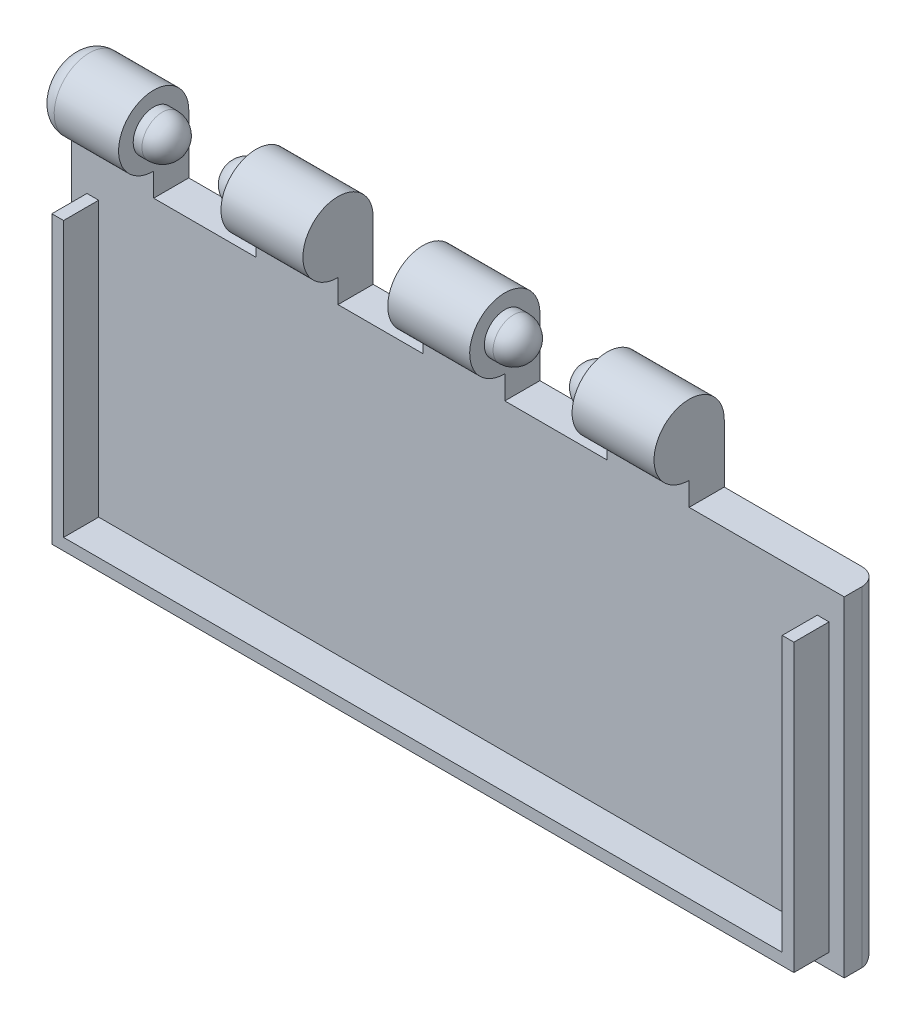
from build123d import *

# Parameters (mm, degrees)
SKETCH1_W                 = 66
SKETCH1_H                 = 28.2
BOSS_EXTRUDE1_DEPTH       = 3
BOSS_EXTRUDE4_DEPTH       = 7
SKETCH17_R                = 1.75
BOSS_EXTRUDE7_DEPTH       = 0.75
REVOLVE4_ANGLE            = 180
LPATTERN2_COUNT           = 2
LPATTERN2_PITCH           = 30
LPATTERN2_COPY_1_DEPTH    = 7
LPATTERN2_COPY_2_SKETCH_R = 1.75
LPATTERN2_COPY_2_DEPTH    = 0.75
LPATTERN2_COPY_3_ANGLE    = 180
FILLET5_R                 = 1.5
BOSS_EXTRUDE3_DEPTH       = 3


with BuildPart() as part:
    # Sketch1 → Boss-Extrude1 (new body)
    with BuildSketch(Plane.XY):
        Rectangle(SKETCH1_W, SKETCH1_H)
    extrude(amount=BOSS_EXTRUDE1_DEPTH)

    # Sketch10 → Boss-Extrude4 (add)
    with BuildSketch(Plane.ZY.offset(33)):
        with BuildLine():
            Line((0, 19.1), (0, 14.1))
            Line((0, 14.1), (3, 14.1))
            Line((3, 14.1), (3, 16.1))
            ThreePointArc((3, 16.1), (5.121320344, 21.221320344), (0, 19.1))
        make_face()
    boss_extrude4 = extrude(amount=-BOSS_EXTRUDE4_DEPTH)

    # Sketch17 → Boss-Extrude7 (add)
    with BuildSketch(Plane(origin=(-26, 0, 0), x_dir=(0, 0, -1), z_dir=(1, 0, 0))):
        with Locations(Location((-3, 19.1, 0), (0, 0, 180))):
            Circle(SKETCH17_R)
    boss_extrude7 = extrude(amount=BOSS_EXTRUDE7_DEPTH)

    # Sketch18 → Revolve4 (revolve)
    with BuildSketch(Plane(origin=(-25.25, 0, 0), x_dir=(0, 0, -1), z_dir=(1, 0, 0))):
        with BuildLine():
            Line((-3, 20.85), (-3, 17.35))
            ThreePointArc((-3, 17.35), (-1.25, 19.1), (-3, 20.85))
        make_face()
    revolve4 = revolve(axis=Axis((-25.25, 20.85, 3), (0, -1, 0)), revolution_arc=REVOLVE4_ANGLE)

    # Mirror1: Boss-Extrude4, Boss-Extrude7, Revolve4 across plane
    add(boss_extrude4.mirror(Plane(origin=(-21.625, 0, 0), x_dir=(0, 0, 1), z_dir=(1, 0, 0))))
    add(boss_extrude7.mirror(Plane(origin=(-21.625, 0, 0), x_dir=(0, 0, 1), z_dir=(1, 0, 0))))
    add(revolve4.mirror(Plane(origin=(-21.625, 0, 0), x_dir=(0, 0, 1), z_dir=(1, 0, 0))))

    # LPattern2: Boss-Extrude4, Boss-Extrude7, Revolve4 ×2
    with Locations(*[(i * LPATTERN2_PITCH, 0, 0) for i in range(1, LPATTERN2_COUNT)]):
        add(boss_extrude4)
        add(boss_extrude7)
        add(revolve4)

    # LPattern2 copy 1 sketch → LPattern2 copy 1 (add)
    with BuildSketch(Plane(origin=(19.75, 0, 0), x_dir=(0, 0, 1), z_dir=(1, 0, 0))):
        with BuildLine():
            Line((0, -19.1), (0, -14.1))
            Line((0, -14.1), (3, -14.1))
            Line((3, -14.1), (3, -16.1))
            ThreePointArc((3, -16.1), (5.121320344, -21.221320344), (0, -19.1))
        make_face()
    extrude(amount=-LPATTERN2_COPY_1_DEPTH)

    # LPattern2 copy 2 sketch → LPattern2 copy 2 (add)
    with BuildSketch(Plane(origin=(12.75, 0, 0), x_dir=(0, 0, -1), z_dir=(-1, 0, 0))):
        with Locations((-3, -19.1)):
            Circle(LPATTERN2_COPY_2_SKETCH_R)
    extrude(amount=LPATTERN2_COPY_2_DEPTH)

    # LPattern2 copy 3 sketch → LPattern2 copy 3 (revolve)
    with BuildSketch(Plane(origin=(12, 0, 0), x_dir=(0, 0, -1), z_dir=(-1, 0, 0))):
        with BuildLine():
            Line((-3, -20.85), (-3, -17.35))
            ThreePointArc((-3, -17.35), (-1.25, -19.1), (-3, -20.85))
        make_face()
    revolve(axis=Axis((12, 20.85, 3), (0, 1, 0)), revolution_arc=LPATTERN2_COPY_3_ANGLE)

    # Fillet5
    fillet5_edges = [part.edges().sort_by_distance(p)[0] for p in [
        (-33, 21.221320344, 5.121320344),
        (0, -14.1, 0),
        (-33, 2.5, 0),
        (33, 0, 0),
    ]]
    fillet(fillet5_edges, radius=FILLET5_R)

    # Sketch9 → Boss-Extrude3 (add)
    with BuildSketch(Plane.XY.offset(3)):
        Polygon((-31.7, 11.6), (-30.7, 11.6), (-30.7, -11.85), (30.7, -11.85), (30.7, 11.6), (31.7, 11.6), (31.7, -11.85), (31.7, -12.85), (-30.7, -12.85), (-31.7, -12.85), align=None)
    extrude(amount=BOSS_EXTRUDE3_DEPTH)


solid = part.part
